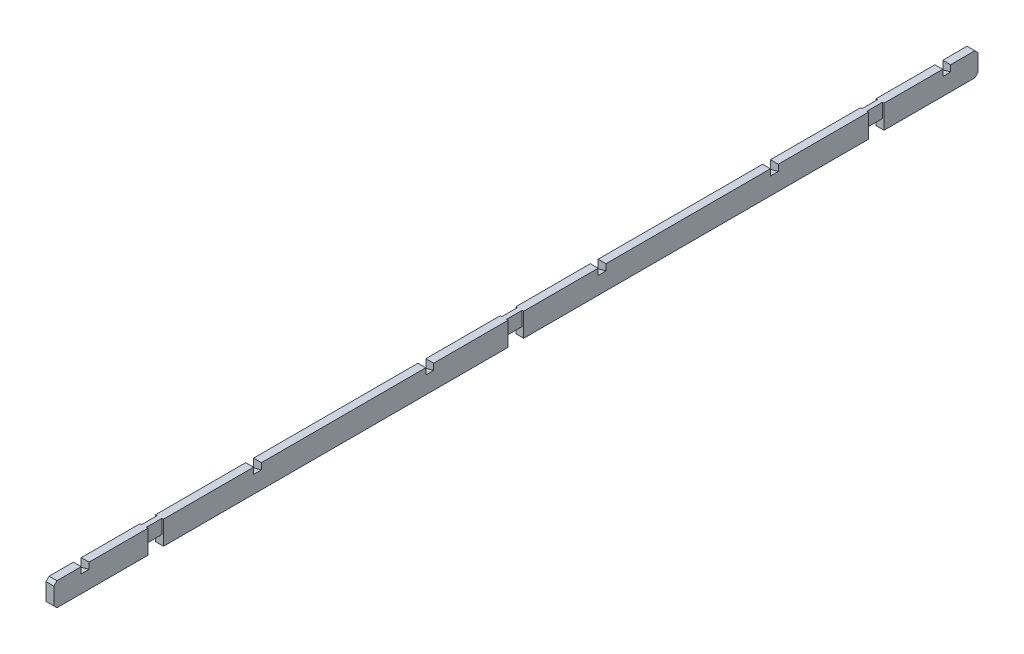
from build123d import *

# Parameters (mm, degrees)
ESQUISSE1_W                = 50
ESQUISSE1_H                = 150
BOSS_EXTRU_1_DEPTH         = 5900
ENL_V_START                = -175
ENL_V_MAT_EXTRU_1_DEPTH    = 50
R_P_TITION_LIN_AIRE1_COUNT = 6
R_P_TITION_LIN_AIRE1_PITCH = 1100
CHANFREIN1_SIZE            = 20
ESQUISSE3_W                = 100
ESQUISSE3_H                = 150
ENL_V_MAT_EXTRU_2_DEPTH    = 10
ENL_V_START_2              = -50
ESQUISSE3_2_W              = 100
ESQUISSE3_2_H              = 150
ENL_V_MAT_EXTRU_3_DEPTH    = 10
ESQUISSE4_W                = 100
ESQUISSE4_H                = 60
ENL_V_MAT_EXTRU_4_DEPTH    = 5903.042019505


with BuildPart() as part:
    # Esquisse1 → Boss.-Extru.1 (new body)
    with BuildSketch(Plane.XY):
        with Locations((25, 75)):
            Rectangle(ESQUISSE1_W, ESQUISSE1_H)
    extrude(amount=BOSS_EXTRU_1_DEPTH)

    # Esquisse2 → Enlèv. mat.-Extru.1 (cut)
    with BuildSketch(Plane.XY.offset(5900).offset(ENL_V_START)):
        Polygon((0, 96.602540378), (50, 110), (50, 150), (0, 150), align=None)
    enl_v_mat_extru_1 = extrude(amount=-ENL_V_MAT_EXTRU_1_DEPTH, mode=Mode.SUBTRACT)

    # Répétition linéaire1: Enlèv. mat.-Extru.1 ×6
    with Locations(*[(0, 0, -i * R_P_TITION_LIN_AIRE1_PITCH) for i in range(1, R_P_TITION_LIN_AIRE1_COUNT)]):
        add(enl_v_mat_extru_1, mode=Mode.SUBTRACT)

    # Chanfrein1
    chanfrein1_edges = [part.edges().sort_by_distance(p)[0] for p in [
        (25, 150, 5900),
        (25, 150, 0),
        (25, 0, 0),
        (25, 0, 5900),
    ]]
    chamfer(chanfrein1_edges, length=CHANFREIN1_SIZE)

    # Esquisse3 → Enlèv. mat.-Extru.2 (cut)
    with BuildSketch(Plane.ZY):
        with Locations((650, 75)):
            Rectangle(ESQUISSE3_W, ESQUISSE3_H)
        with Locations((2950, 75)):
            Rectangle(ESQUISSE3_W, ESQUISSE3_H)
        with Locations((5250, 75)):
            Rectangle(ESQUISSE3_W, ESQUISSE3_H)
    extrude(amount=-ENL_V_MAT_EXTRU_2_DEPTH, mode=Mode.SUBTRACT)

    # Esquisse3<2> → Enlèv. mat.-Extru.3 (cut)
    with BuildSketch(Plane.ZY.offset(ENL_V_START_2)):
        with Locations((650, 75)):
            Rectangle(ESQUISSE3_2_W, ESQUISSE3_2_H)
        with Locations((2950, 75)):
            Rectangle(ESQUISSE3_2_W, ESQUISSE3_2_H)
        with Locations((5250, 75)):
            Rectangle(ESQUISSE3_2_W, ESQUISSE3_2_H)
    extrude(amount=ENL_V_MAT_EXTRU_3_DEPTH, mode=Mode.SUBTRACT)

    # Esquisse4 → Enlèv. mat.-Extru.4 (cut, through all)
    with BuildSketch(Plane.ZY.offset(-10)):
        with Locations((650, 30)):
            Rectangle(ESQUISSE4_W, ESQUISSE4_H)
        with Locations((2950, 30)):
            Rectangle(ESQUISSE4_W, ESQUISSE4_H)
        with Locations((5250, 30)):
            Rectangle(ESQUISSE4_W, ESQUISSE4_H)
    extrude(amount=-ENL_V_MAT_EXTRU_4_DEPTH, mode=Mode.SUBTRACT)


solid = part.part
